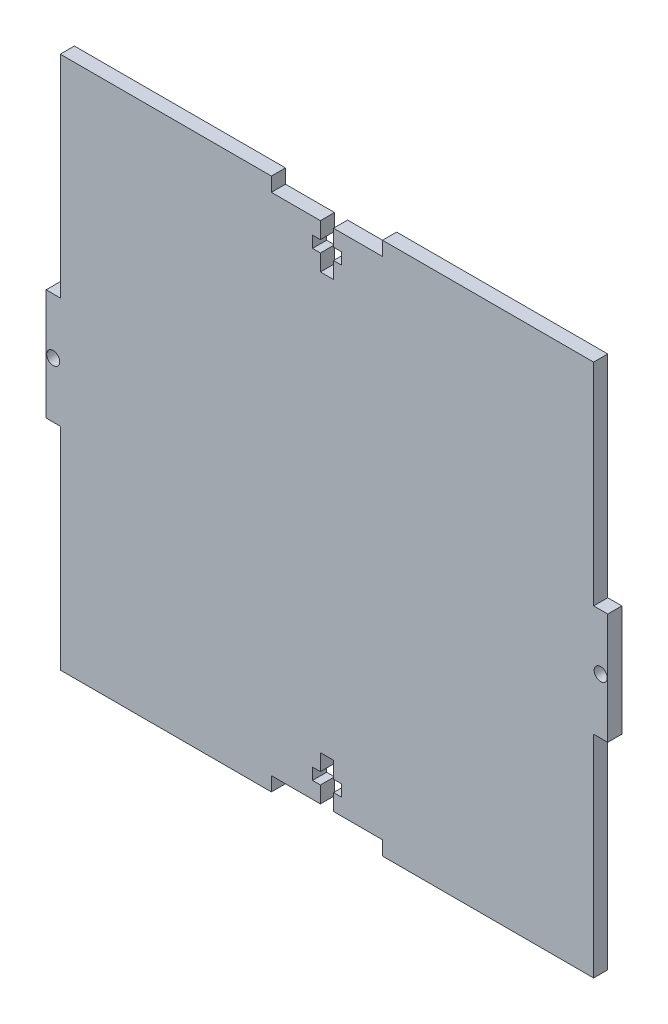
from build123d import *

# Parameters (mm, degrees)
SKETCH1_R           = 1.47
BOSS_EXTRUDE1_DEPTH = 1.5875


with BuildPart() as part:
    # Sketch1 → Boss-Extrude1 (new, symmetric)
    with BuildSketch(Plane.XY):
        Polygon((-12.5, 60), (-60, 60), (-60, 12.5), (-63.175, 12.5), (-63.175, -12.5), (-60, -12.5), (-60, -60), (-12.5, -60), (-12.5, -56.825), (-1.47, -56.825), (-1.47, -53.125), (-3.25, -53.125), (-3.25, -50.525), (-1.47, -50.525), (-1.47, -46.825), (1.47, -46.825), (1.47, -50.525), (3.25, -50.525), (3.25, -53.125), (1.47, -53.125), (1.47, -56.825), (12.5, -56.825), (12.5, -60), (60, -60), (60, -12.5), (63.175, -12.5), (63.175, 12.5), (60, 12.5), (60, 60), (12.5, 60), (12.5, 56.825), (1.47, 56.825), (1.47, 53.125), (3.25, 53.125), (3.25, 50.525), (1.47, 50.525), (1.47, 46.825), (-1.47, 46.825), (-1.47, 50.525), (-3.25, 50.525), (-3.25, 53.125), (-1.47, 53.125), (-1.47, 56.825), (-12.5, 56.825), align=None)
        with Locations((-61.5875, 0)):
            Circle(SKETCH1_R, mode=Mode.SUBTRACT)
        with Locations(Location((61.5875, 0, 0), (0, 0, 180))):
            Circle(SKETCH1_R, mode=Mode.SUBTRACT)
    extrude(amount=BOSS_EXTRUDE1_DEPTH, both=True)


solid = part.part
